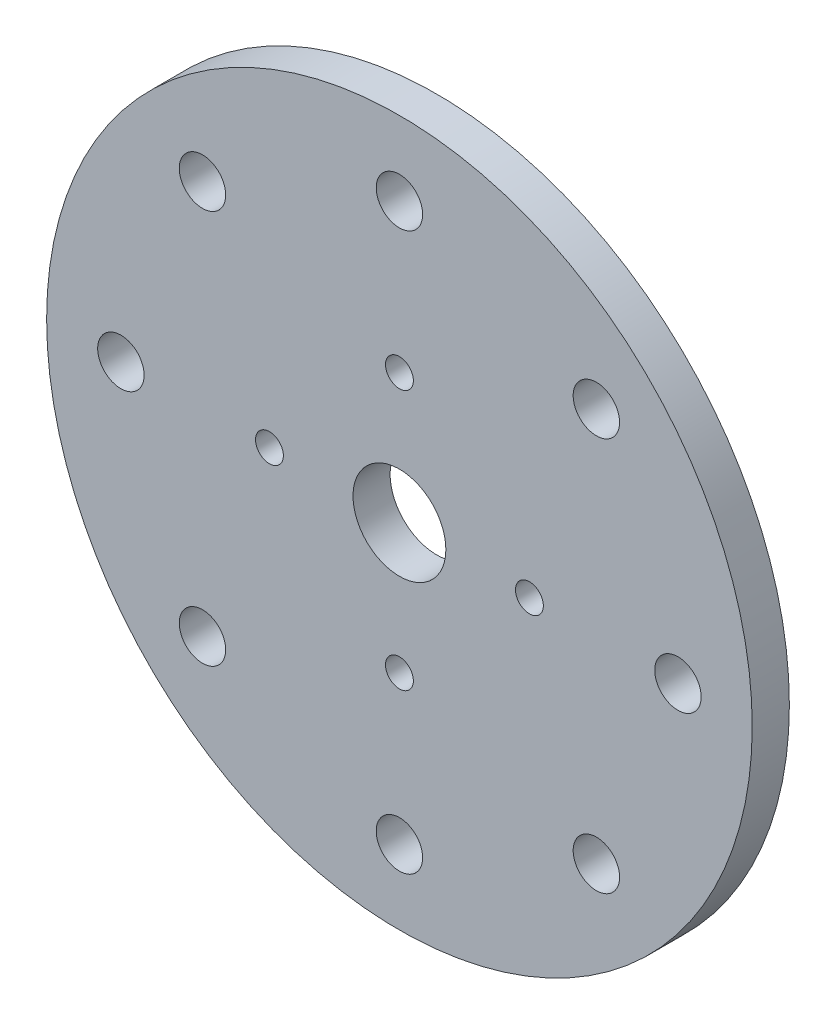
from build123d import *

# Parameters (mm, degrees)
SKETCH_1_R      = 38
SKETCH_1_R_2    = 5
SKETCH_1_R_3    = 2.5
SKETCH_1_R_4    = 1.5
EXTRUDE_2_DEPTH = 4


with BuildPart() as part:
    # 草图1 → 凸台-拉伸2 (new body)
    with BuildSketch(Plane.XY):
        Circle(SKETCH_1_R)
        Circle(SKETCH_1_R_2, mode=Mode.SUBTRACT)
        with Locations((0, 30)):
            Circle(SKETCH_1_R_3, mode=Mode.SUBTRACT)
        with Locations((21.213203436, 21.213203436)):
            Circle(SKETCH_1_R_3, mode=Mode.SUBTRACT)
        with Locations((30, 0)):
            Circle(SKETCH_1_R_3, mode=Mode.SUBTRACT)
        with Locations((21.213203436, -21.213203436)):
            Circle(SKETCH_1_R_3, mode=Mode.SUBTRACT)
        with Locations((0, -30)):
            Circle(SKETCH_1_R_3, mode=Mode.SUBTRACT)
        with Locations((-21.213203436, -21.213203436)):
            Circle(SKETCH_1_R_3, mode=Mode.SUBTRACT)
        with Locations((-30, 0)):
            Circle(SKETCH_1_R_3, mode=Mode.SUBTRACT)
        with Locations((-21.213203436, 21.213203436)):
            Circle(SKETCH_1_R_3, mode=Mode.SUBTRACT)
        with Locations((0, 14)):
            Circle(SKETCH_1_R_4, mode=Mode.SUBTRACT)
        with Locations((14, 0)):
            Circle(SKETCH_1_R_4, mode=Mode.SUBTRACT)
        with Locations((0, -14)):
            Circle(SKETCH_1_R_4, mode=Mode.SUBTRACT)
        with Locations((-14, 0)):
            Circle(SKETCH_1_R_4, mode=Mode.SUBTRACT)
    extrude(amount=EXTRUDE_2_DEPTH)


solid = part.part
